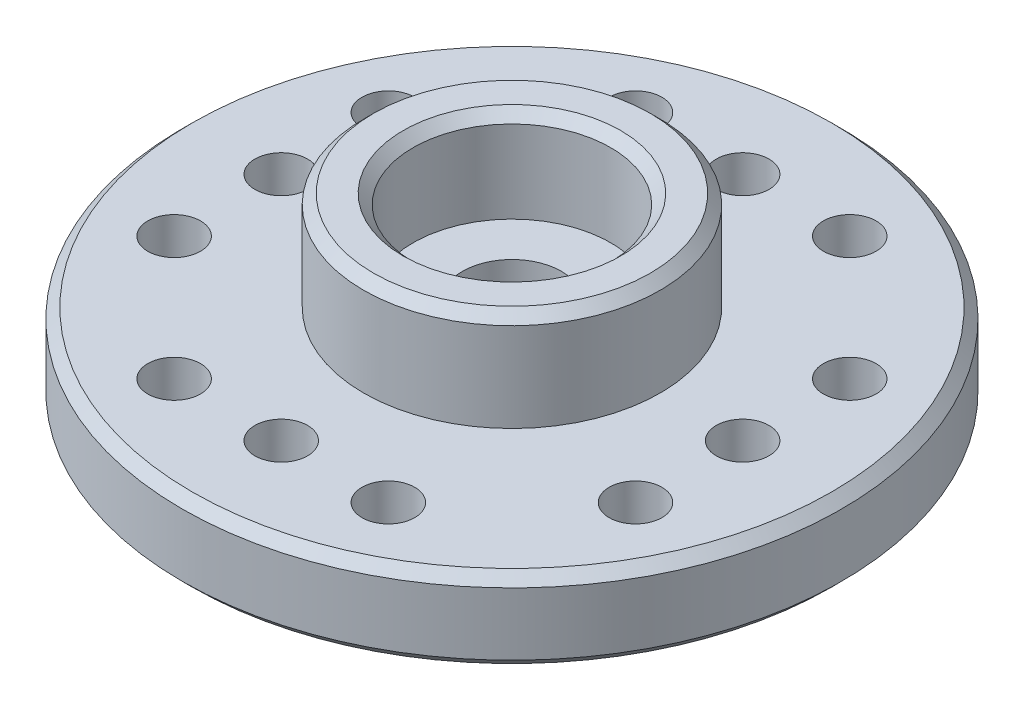
from build123d import *

# Parameters (mm, degrees)
SKETCH_1_R          = 10
EXTRUDE_1_DEPTH     = 2.5
SKETCH_2_R          = 4.5
EXTRUDE_2_DEPTH     = 3
SKETCH_3_R          = 3
CUT_EXTRUDE_1_DEPTH = 2.8
SKETCH_4_R          = 0.8
SKETCH_4_R_2        = 1.5
CUT_EXTRUDE_2_DEPTH = 16.173990905
CHAMFER_1_SIZE      = 0.3
SKETCH_5_R          = 4.5
SKETCH_5_R_2        = 3.5
SKETCH_5_R_3        = 3
SKETCH_5_R_4        = 1.5
CUT_EXTRUDE_3_DEPTH = 1


with BuildPart() as part:
    # 草图1 → 凸台-拉伸1 (new body)
    with BuildSketch(Plane(origin=(0, 0, 0), x_dir=(1, 0, 0), z_dir=(0, 1, 0))):
        with Locations(Location((0, 0, 0), (0, 0, 270))):
            Circle(SKETCH_1_R)
    extrude(amount=EXTRUDE_1_DEPTH)

    # 草图2 → 凸台-拉伸2 (add)
    with BuildSketch(Plane(origin=(0, 2.5, 0), x_dir=(1, 0, 0), z_dir=(0, 1, 0))):
        with Locations(Location((0, 0, 0), (0, 0, 270))):
            Circle(SKETCH_2_R)
    extrude(amount=EXTRUDE_2_DEPTH)

    # 草图3 → 切除-拉伸1 (cut)
    with BuildSketch(Plane(origin=(0, 5.5, 0), x_dir=(1, 0, 0), z_dir=(0, 1, 0))):
        with Locations(Location((0, 0, 0), (0, 0, 270))):
            Circle(SKETCH_3_R)
    extrude(amount=-CUT_EXTRUDE_1_DEPTH, mode=Mode.SUBTRACT)

    # 草图4 → 切除-拉伸2 (cut, through all)
    with BuildSketch(Plane.XZ):
        with Locations(Location((0, 7, 0), (0, 0, 270))):
            Circle(SKETCH_4_R)
        with Locations(Location((0, 0, 0), (0, 0, 270))):
            Circle(SKETCH_4_R_2)
        with Locations(Location((-3.25, 7, 0), (0, 0, 270))):
            Circle(SKETCH_4_R)
        with Locations(Location((3.25, 7, 0), (0, 0, 270))):
            Circle(SKETCH_4_R)
        with Locations(Location((7, 0, 0), (0, 0, 270))):
            Circle(SKETCH_4_R)
        with Locations(Location((7, 3.25, 0), (0, 0, 270))):
            Circle(SKETCH_4_R)
        with Locations(Location((7, -3.25, 0), (0, 0, 270))):
            Circle(SKETCH_4_R)
        with Locations(Location((0, -7, 0), (0, 0, 270))):
            Circle(SKETCH_4_R)
        with Locations(Location((3.25, -7, 0), (0, 0, 270))):
            Circle(SKETCH_4_R)
        with Locations(Location((-3.25, -7, 0), (0, 0, 270))):
            Circle(SKETCH_4_R)
        with Locations(Location((-7, 0, 0), (0, 0, 270))):
            Circle(SKETCH_4_R)
        with Locations(Location((-7, -3.25, 0), (0, 0, 270))):
            Circle(SKETCH_4_R)
        with Locations(Location((-7, 3.25, 0), (0, 0, 270))):
            Circle(SKETCH_4_R)
    extrude(amount=-CUT_EXTRUDE_2_DEPTH, mode=Mode.SUBTRACT)

    # 倒角1
    chamfer_1_edges = [part.edges().sort_by_distance(p)[0] for p in [
        (0, 5.5, -3),
        (0, 0, -10),
        (0, 2.5, -10),
        (0, 5.5, -4.5),
    ]]
    chamfer(chamfer_1_edges, length=CHAMFER_1_SIZE)

    # 草图5 → 切除-拉伸3 (cut)
    # profile 1 of 2: a face of its own
    with BuildSketch(Plane.XZ):
        with Locations(Location((0, 0, 0), (0, 0, 90))):
            Circle(SKETCH_5_R)
        with Locations(Location((0, 0, 0), (0, 0, 270))):
            Circle(SKETCH_5_R_2, mode=Mode.SUBTRACT)
    # profile 2 of 2: a face of its own
    with BuildSketch(Plane.XZ):
        with Locations(Location((0, 0, 0), (0, 0, 90))):
            Circle(SKETCH_5_R_3)
        with Locations(Location((0, 0, 0), (0, 0, 270))):
            Circle(SKETCH_5_R_4, mode=Mode.SUBTRACT)
    extrude(amount=-CUT_EXTRUDE_3_DEPTH, mode=Mode.SUBTRACT)


solid = part.part
